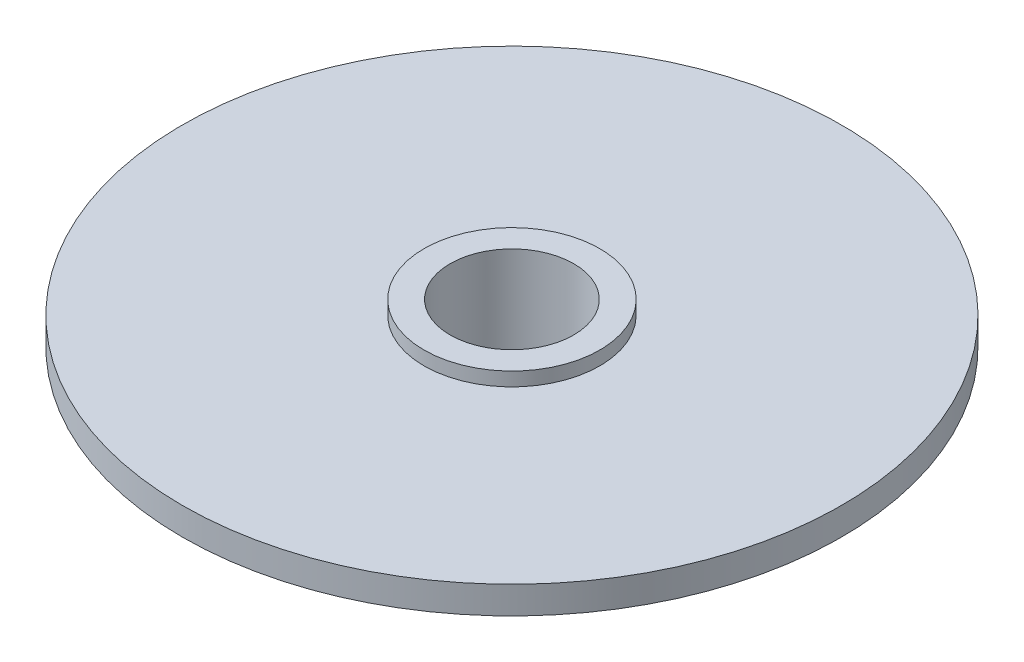
from build123d import *
from build123d.topology import SkipClean

# Parameters (mm, degrees)
SKETCH_1_R      = 120
SKETCH_1_R_2    = 22.5
EXTRUDE_1_DEPTH = 10
EXTRUDE_START   = 40
SKETCH_2_R      = 32
SKETCH_2_R_2    = 22.5
EXTRUDE_2_DEPTH = 40
SKETCH_3_R      = 32
SKETCH_3_R_2    = 22.5
EXTRUDE_3_DEPTH = 5


with BuildPart() as part:
    # 草图1 → 凸台-拉伸1 (new body)
    with BuildSketch(Plane(origin=(0, 0, 0), x_dir=(1, 0, 0), z_dir=(0, 1, 0))):
        with Locations(Location((0, 0, 0), (0, 0, 270))):
            Circle(SKETCH_1_R)
        with Locations(Location((0, 0, 0), (0, 0, 270))):
            Circle(SKETCH_1_R_2, mode=Mode.SUBTRACT)
    extrude(amount=EXTRUDE_1_DEPTH)

    # 草图2 → 凸台-拉伸2 (add)
    with SkipClean():  # the faces are left unmerged after this step: merging them gives an invalid solid
        with BuildSketch(Plane.XZ.offset(EXTRUDE_START)):
            with Locations(Location((0, 0, 0), (0, 0, 90))):
                Circle(SKETCH_2_R)
            with Locations(Location((0, 0, 0), (0, 0, 270))):
                Circle(SKETCH_2_R_2, mode=Mode.SUBTRACT)
        extrude(amount=-EXTRUDE_2_DEPTH)

    # 草图3 → 凸台-拉伸3 (add)
    with BuildSketch(Plane(origin=(0, 10, 0), x_dir=(1, 0, 0), z_dir=(0, 1, 0))):
        with Locations(Location((0, 0, 0), (0, 0, 270))):
            Circle(SKETCH_3_R)
        with Locations(Location((0, 0, 0), (0, 0, 90))):
            Circle(SKETCH_3_R_2, mode=Mode.SUBTRACT)
    extrude(amount=EXTRUDE_3_DEPTH)


solid = part.part
